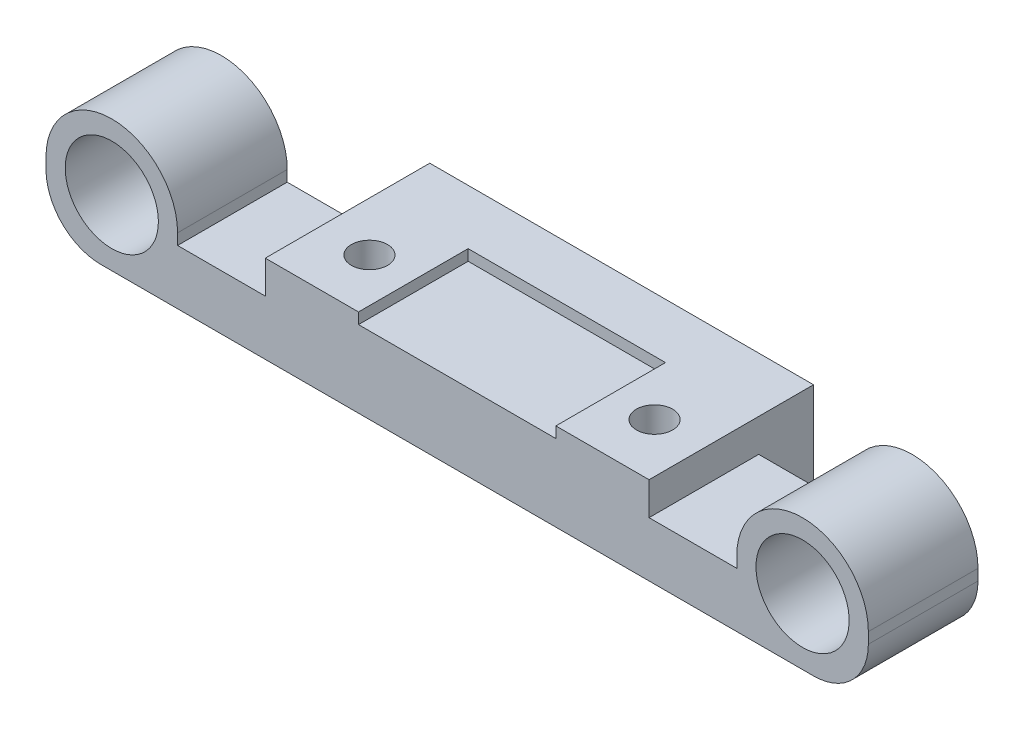
from build123d import *

# Parameters (mm, degrees)
SKETCH2_W           = 17
SKETCH2_H           = 2.75
BOSS_EXTRUDE1_DEPTH = 8
BOSS_EXTRUDE3_DEPTH = 8
SKETCH5_R           = 3
CUT_EXTRUDE1_DEPTH  = 3
SKETCH6_R           = 1.65
CUT_EXTRUDE2_DEPTH  = 8
FILLET14_R          = 2
FILLET15_R          = 2
FILLET16_R          = 2
SKETCH7_W           = 18
SKETCH7_H           = 10
CUT_EXTRUDE3_DEPTH  = 1
FILLET18_R          = 1.4
BOSS_EXTRUDE4_DEPTH = 10
SKETCH10_R          = 4.25
CUT_EXTRUDE4_DEPTH  = 8
FILLET17_R          = 2
FILLET19_R          = 5
SKETCH11_W          = 35
SKETCH11_H          = 13.55262527
CUT_EXTRUDE5_DEPTH  = 46.43556564


with BuildPart() as part:
    # Sketch2 → Boss-Extrude1 (new body)
    with BuildSketch(Plane(origin=(0, 0, 0), x_dir=(1, 0, 0), z_dir=(0, 1, 0))):
        Rectangle(SKETCH2_W, SKETCH2_H)
    extrude(amount=BOSS_EXTRUDE1_DEPTH)

    # Sketch3 → Boss-Extrude3 (add)
    with BuildSketch(Plane(origin=(0, 0, 0), x_dir=(1, 0, 0), z_dir=(0, 1, 0))):
        Polygon((4, -9.375), (17.5, -9.375), (17.5, -24.375), (-17.5, -24.375), (-17.5, -9.375), (-4, -9.375), (-4, -1.375), (4, -1.375), align=None)
    extrude(amount=BOSS_EXTRUDE3_DEPTH)

    # Sketch5 → Cut-Extrude1 (cut)
    with BuildSketch(Plane.XZ):
        with Locations(Location((13, 19.375, 0), (0, 0, 270))):
            Circle(SKETCH5_R)
        with Locations(Location((-13, 19.375, 0), (0, 0, 270))):
            Circle(SKETCH5_R)
    extrude(amount=-CUT_EXTRUDE1_DEPTH, mode=Mode.SUBTRACT)

    # Sketch6 → Cut-Extrude2 (cut)
    with BuildSketch(Plane.XZ):
        with Locations(Location((-13, 19.375, 0), (0, 0, 270))):
            Circle(SKETCH6_R)
        with Locations(Location((13, 19.375, 0), (0, 0, 270))):
            Circle(SKETCH6_R)
    extrude(amount=-CUT_EXTRUDE2_DEPTH, mode=Mode.SUBTRACT)

    # Fillet14
    fillet14_edges = [part.edges().sort_by_distance(p)[0] for p in [
        (-4, 4, 9.375),
    ]]
    fillet(fillet14_edges, radius=FILLET14_R)

    # Fillet15
    fillet15_edges = [part.edges().sort_by_distance(p)[0] for p in [
        (4, 4, 9.375),
    ]]
    fillet(fillet15_edges, radius=FILLET15_R)

    # Fillet16
    fillet16_edges = [part.edges().sort_by_distance(p)[0] for p in [
        (-4, 4, 1.375),
    ]]
    fillet(fillet16_edges, radius=FILLET16_R)

    # Sketch7 → Cut-Extrude3 (cut)
    with BuildSketch(Plane(origin=(0, 8, 0), x_dir=(1, 0, 0), z_dir=(0, 1, 0))):
        with Locations((0, -19.375)):
            Rectangle(SKETCH7_W, SKETCH7_H)
    extrude(amount=-CUT_EXTRUDE3_DEPTH, mode=Mode.SUBTRACT)

    # Fillet18
    fillet18_edges = [part.edges().sort_by_distance(p)[0] for p in [
        (8.5, 8, 0),
        (-8.5, 8, 0),
        (8.5, 0, 0),
        (-8.5, 0, 0),
    ]]
    fillet(fillet18_edges, radius=FILLET18_R)

    # Sketch9 → Boss-Extrude4 (add)
    with BuildSketch(Plane.XY.offset(24.375)):
        with BuildLine():
            Line((-17.5, 0), (-37.5, 0))
            Line((-37.5, 0), (-37.5, 6))
            ThreePointArc((-37.5, 6), (-31.5, 12), (-25.5, 6))
            Line((-25.5, 6), (-25.5, 5))
            Line((-25.5, 5), (-17.5, 5))
            Line((-17.5, 5), (-17.5, 0))
        make_face()
        with BuildLine():
            Line((25.5, 6), (25.5, 5))
            Line((25.5, 5), (17.5, 5))
            Line((17.5, 5), (17.5, 0))
            Line((17.5, 0), (37.5, 0))
            Line((37.5, 0), (37.5, 6))
            ThreePointArc((37.5, 6), (31.5, 12), (25.5, 6))
        make_face()
    extrude(amount=-BOSS_EXTRUDE4_DEPTH)

    # Sketch10 → Cut-Extrude4 (cut)
    with BuildSketch(Plane.XY.offset(24.375)):
        with Locations((-31.5, 6)):
            Circle(SKETCH10_R)
        with Locations(Location((31.5, 6, 0), (0, 0, 180))):
            Circle(SKETCH10_R)
    extrude(amount=-CUT_EXTRUDE4_DEPTH, mode=Mode.SUBTRACT)

    # Fillet17
    fillet17_edges = [part.edges().sort_by_distance(p)[0] for p in [
        (4, 4, 1.375),
    ]]
    fillet(fillet17_edges, radius=FILLET17_R)

    # Fillet19
    fillet19_edges = [part.edges().sort_by_distance(p)[0] for p in [
        (-37.5, 0, 19.375),
        (37.5, 0, 19.375),
    ]]
    fillet(fillet19_edges, radius=FILLET19_R)

    # Sketch11 → Cut-Extrude5 (cut, through all)
    with BuildSketch(Plane(origin=(0, 8, 0), x_dir=(1, 0, 0), z_dir=(0, 1, 0))):
        with Locations((0, -2.598687365)):
            Rectangle(SKETCH11_W, SKETCH11_H)
    extrude(amount=-CUT_EXTRUDE5_DEPTH, mode=Mode.SUBTRACT)


solid = part.part
